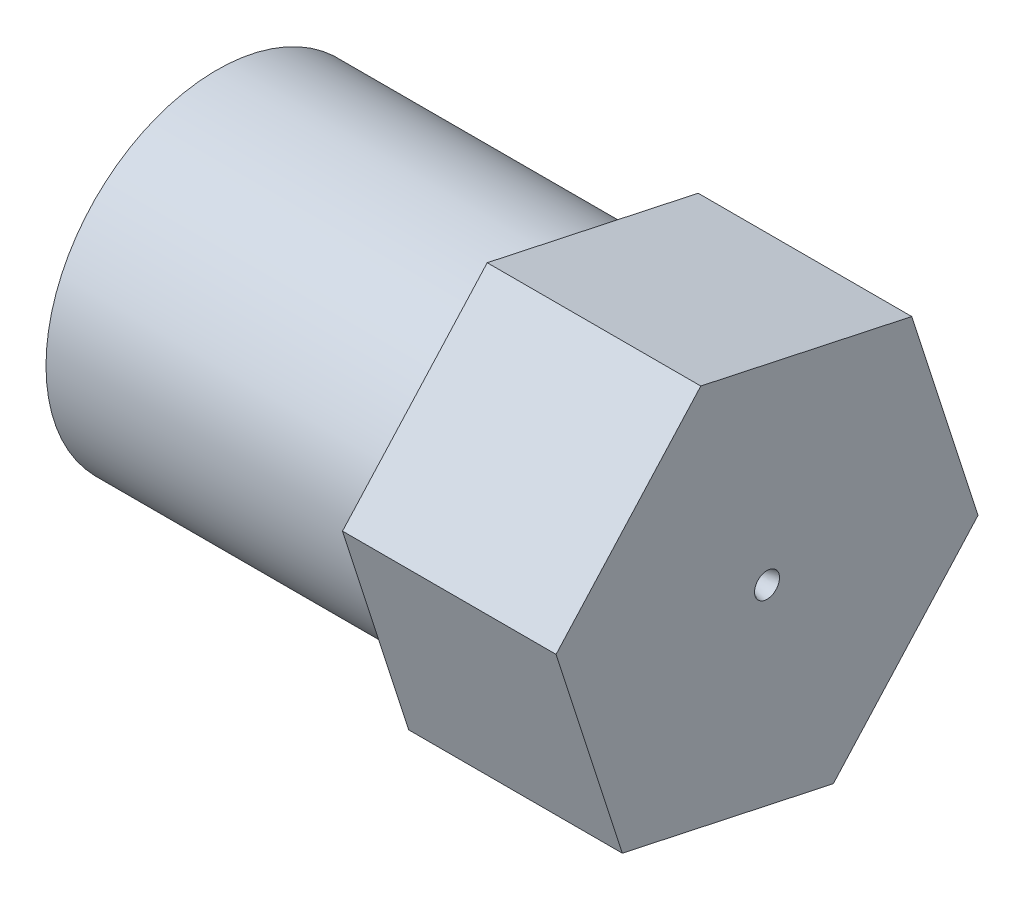
from build123d import *

# Parameters (mm, degrees)
SKETCH4_R           = 10.16
BOSS_EXTRUDE1_DEPTH = 12.7
FILLET1_R           = 0.635


with BuildPart() as part:
    # Sketch1 → Revolve1 (revolve)
    with BuildSketch(Plane.XY, mode=Mode.PRIVATE) as revolve1_sk:
        with BuildLine():
            Line((-0.530330086, 0.719669914), (-3.325724202, 3.51506403))
            ThreePointArc((-3.325724202, 3.51506403), (-4.355768335, 4.203317516), (-5.570788232, 4.445))
            Line((-5.570788232, 4.445), (-13.462, 4.445))
            Line((-13.462, 4.445), (-13.462, 4.699))
            ThreePointArc((-13.462, 4.699), (-13.499197439, 4.788802561), (-13.589, 4.826))
            Line((-13.589, 4.826), (-19.304, 4.826))
            ThreePointArc((-19.304, 4.826), (-19.753012806, 5.011987194), (-19.939, 5.461))
            Line((-19.939, 5.461), (-19.939, 6.8199))
            ThreePointArc((-19.939, 6.8199), (-19.976197439, 6.909702561), (-20.066, 6.9469))
            Line((-20.066, 6.9469), (-24.892, 6.9469))
            Line((-24.892, 6.9469), (-24.892, 7.8994))
            ThreePointArc((-24.892, 7.8994), (-24.929197439, 7.989202561), (-25.019, 8.0264))
            Line((-25.019, 8.0264), (-31.115, 8.0264))
            ThreePointArc((-31.115, 8.0264), (-31.564012806, 8.212387194), (-31.75, 8.6614))
            Line((-31.75, 8.6614), (-31.75, 10.16))
            Line((-31.75, 10.16), (-11.729972483, 10.16))
            Line((-11.729972483, 10.16), (0.969508534, 10.16))
            Line((0.969508534, 10.16), (0.969508534, 0.741619849))
            add(Edge.make_bspline(
                [(0.969508534, 0.741619849), (0.500451636, 0.675698201), (0.068404029, 0.512061476)],
                knots=[0, 0, 0, 1, 1, 1], degree=2))
            ThreePointArc((0.068404029, 0.512061476), (0.034729636, 0.503038449), (0, 0.5))
            ThreePointArc((0, 0.5), (-0.287012574, 0.557090351), (-0.530330086, 0.719669914))
        make_face()
    revolve(revolve1_sk.sketch.rotate(Axis((0, 0, 0), (1, 0, 0)), 90), axis=Axis((0, 0, 0), (1, 0, 0)))

    # Sketch4 → Boss-Extrude1 (add)
    with BuildSketch(Plane(origin=(0.969508534, 0, 0), x_dir=(0, 0, -1), z_dir=(1, 0, 0))):
        Polygon((3.940411868, -12.211607701), (12.545768424, -2.693307071), (8.605356556, 9.51830063), (-3.940411868, 12.211607701), (-12.545768424, 2.693307071), (-8.605356556, -9.51830063), align=None)
        with Locations(Location((0, 0, 0), (0, 0, 180))):
            Circle(SKETCH4_R, mode=Mode.SUBTRACT)
    extrude(amount=-BOSS_EXTRUDE1_DEPTH)

    # Fillet1
    fillet1_edges = [part.edges().sort_by_distance(p)[0] for p in [
        (-11.730491466, 0, -10.16),
    ]]
    fillet(fillet1_edges, radius=FILLET1_R)


solid = part.part
